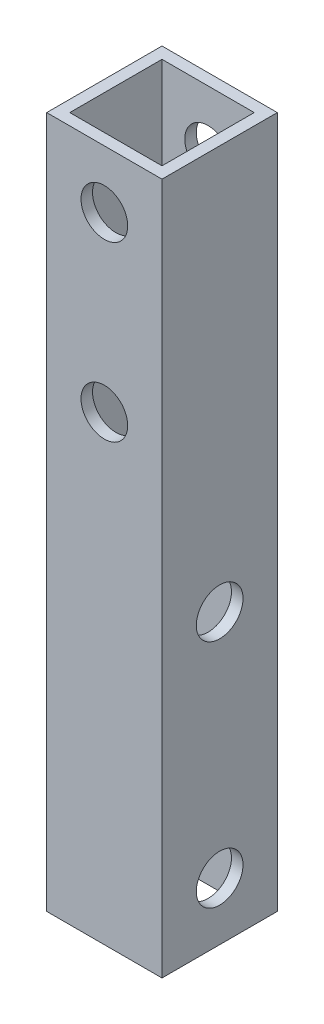
from build123d import *

# Parameters (mm, degrees)
SKETCH1_W           = 10
SKETCH1_H           = 10
SKETCH1_W_2         = 8
SKETCH1_H_2         = 8
BOSS_EXTRUDE1_DEPTH = 60
SKETCH2_R           = 2.025
CUT_EXTRUDE1_DEPTH  = 62.032778079
SKETCH4_R           = 2.025
CUT_EXTRUDE2_DEPTH  = 62.032778079


with BuildPart() as part:
    # Sketch1 → Boss-Extrude1 (new body)
    with BuildSketch(Plane(origin=(0, 0, 0), x_dir=(1, 0, 0), z_dir=(0, 1, 0))):
        Rectangle(SKETCH1_W, SKETCH1_H)
        Rectangle(SKETCH1_W_2, SKETCH1_H_2, mode=Mode.SUBTRACT)
    extrude(amount=BOSS_EXTRUDE1_DEPTH)

    # Sketch2 → Cut-Extrude1 (cut, through all)
    with BuildSketch(Plane(origin=(5, 0, 0), x_dir=(0, 0, -1), z_dir=(1, 0, 0))):
        with Locations((0, 5)):
            Circle(SKETCH2_R)
        with Locations((0, 25)):
            Circle(SKETCH2_R)
    extrude(amount=-CUT_EXTRUDE1_DEPTH, mode=Mode.SUBTRACT)

    # Sketch4 → Cut-Extrude2 (cut, through all)
    with BuildSketch(Plane.XY.offset(5)):
        with Locations((0, 55)):
            Circle(SKETCH4_R)
        with Locations((0, 40)):
            Circle(SKETCH4_R)
    extrude(amount=-CUT_EXTRUDE2_DEPTH, mode=Mode.SUBTRACT)


solid = part.part
